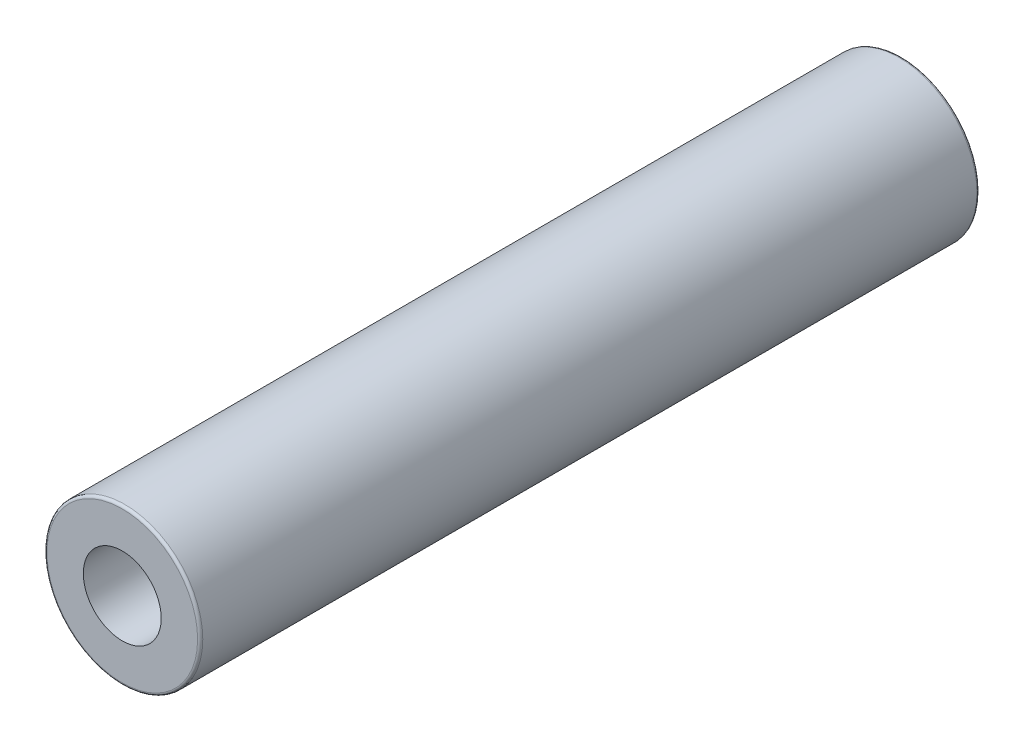
from build123d import *

# Parameters (mm, degrees)
SKETCH_1_R      = 3
SKETCH_1_R_2    = 1.5
EXTRUDE_1_DEPTH = 30
FILLET_1_R      = 0.1


with BuildPart() as part:
    # ｽｹｯﾁ1 → ﾎﾞｽ - 押し出し1 (new body)
    with BuildSketch(Plane.XY):
        Circle(SKETCH_1_R)
        Circle(SKETCH_1_R_2, mode=Mode.SUBTRACT)
    extrude(amount=EXTRUDE_1_DEPTH)

    # ﾌｨﾚｯﾄ1
    fillet_1_edges = [part.edges().sort_by_distance(p)[0] for p in [
        (-3, 0, 0),
        (-3, 0, 30),
    ]]
    fillet(fillet_1_edges, radius=FILLET_1_R)


solid = part.part
